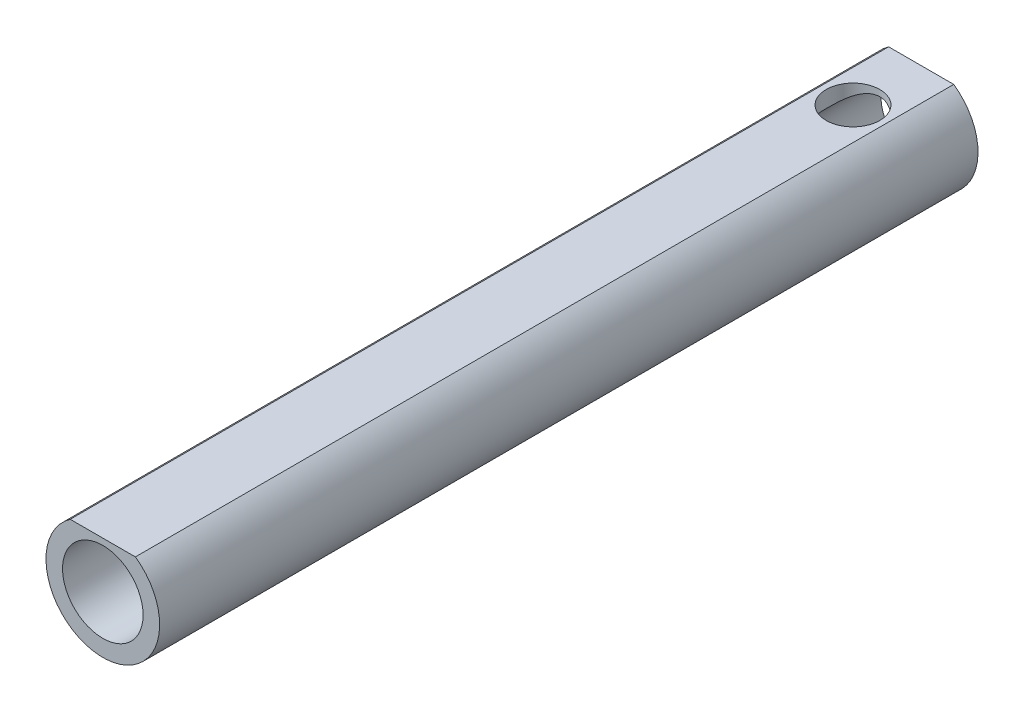
from build123d import *

# Parameters (mm, degrees)
SKETCH1_R           = 3.175
SKETCH1_R_2         = 2.25
BOSS_EXTRUDE1_DEPTH = 45.72
SKETCH2_W           = 3.810610938
SKETCH2_H           = 3.347268665
CUT_EXTRUDE1_DEPTH  = 48.514
SKETCH3_R           = 1.5
CUT_EXTRUDE2_DEPTH  = 2.54


with BuildPart() as part:
    # Sketch1 → Boss-Extrude1 (new body)
    with BuildSketch(Plane.XY):
        Circle(SKETCH1_R)
        Circle(SKETCH1_R_2, mode=Mode.SUBTRACT)
    extrude(amount=BOSS_EXTRUDE1_DEPTH)

    # Sketch2 → Cut-Extrude1 (cut)
    with BuildSketch(Plane.XY.offset(45.72)):
        with Locations((0.085656613, 4.275461199)):
            Rectangle(SKETCH2_W, SKETCH2_H)
    extrude(amount=-CUT_EXTRUDE1_DEPTH, mode=Mode.SUBTRACT)

    # Sketch3 → Cut-Extrude2 (cut)
    with BuildSketch(Plane(origin=(0, 2.601826866, 0), x_dir=(1, 0, 0), z_dir=(0, 1, 0))):
        with Locations(Location((0, -3.81, 0), (0, 0, 270))):
            Circle(SKETCH3_R)
    extrude(amount=-CUT_EXTRUDE2_DEPTH, mode=Mode.SUBTRACT)


solid = part.part
